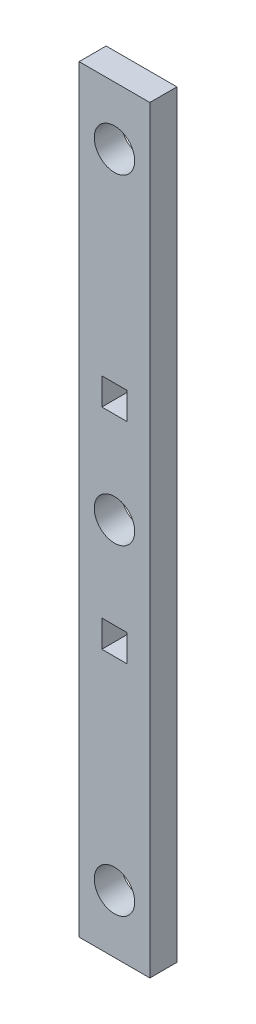
from build123d import *

# Parameters (mm, degrees)
MODEL_W             = 14
MODEL_H             = 150
MODEL_R             = 4
MODEL_W_2           = 5
MODEL_H_2           = 5.35
BOSS_EXTRUDE1_DEPTH = 5.35


with BuildPart() as part:
    # Model → Boss-Extrude1 (new body)
    with BuildSketch(Plane.XY):
        with Locations((7, 75)):
            Rectangle(MODEL_W, MODEL_H)
        with Locations((7, 138.5)):
            Circle(MODEL_R, mode=Mode.SUBTRACT)
        with Locations((7, 75)):
            Circle(MODEL_R, mode=Mode.SUBTRACT)
        with Locations(Location((7, 11.5, 0), (0, 0, 180))):
            Circle(MODEL_R, mode=Mode.SUBTRACT)
        with Locations((7, 95.75)):
            Rectangle(MODEL_W_2, MODEL_H_2, mode=Mode.SUBTRACT)
        with Locations((7, 54.25)):
            Rectangle(MODEL_W_2, MODEL_H_2, mode=Mode.SUBTRACT)
    extrude(amount=BOSS_EXTRUDE1_DEPTH)


solid = part.part
